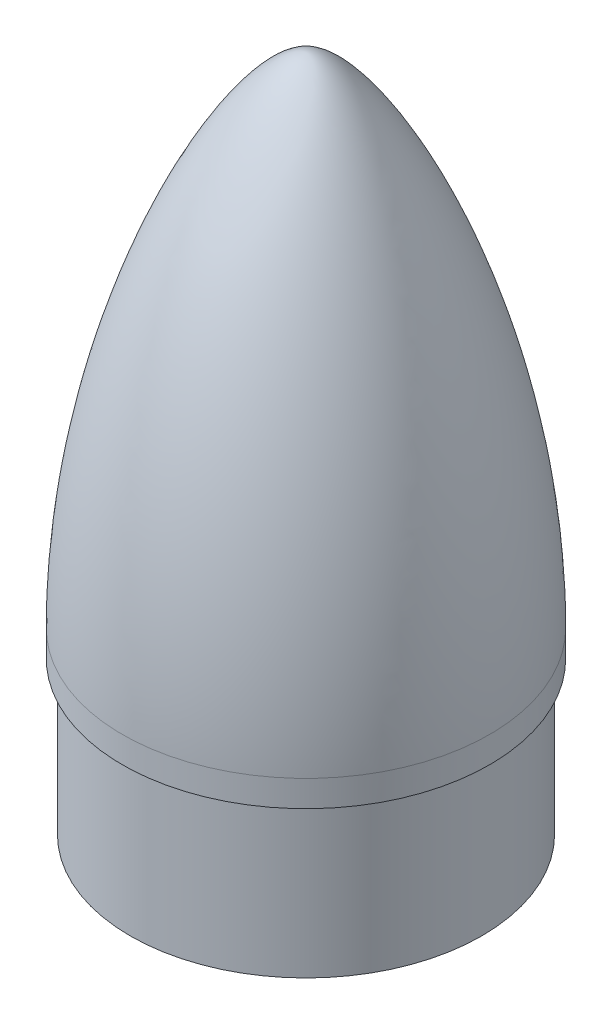
from build123d import *

# Parameters (mm, degrees)
BOSS_EXTRUDE1_START = -2
SKETCH2_R           = 33.5
BOSS_EXTRUDE1_DEPTH = 2
SKETCH3_W           = 10
SKETCH3_H           = 15
CUT_EXTRUDE1_DEPTH  = 2


with BuildPart() as part:
    # Sketch1 → Revolve1 (revolve)
    with BuildSketch(Plane.XY, mode=Mode.PRIVATE) as revolve1_sk:
        with BuildLine():
            Line((-33.5, 0), (-33.5, 29))
            Line((-33.5, 29), (-35, 29))
            Line((-35, 29), (-35, 34))
            add(Edge.make_bspline(
                [(-35, 34), (-35, 84.230477341), (-10.204077545, 129), (0, 129)],
                knots=[0, 0, 0, 0, 1, 1, 1, 1], degree=3))
            Line((0, 129), (0, 128))
            add(Edge.make_bspline(
                [(-33.998483451, 34.678650605), (-33.991581263, 36.224092512), (-33.93035746, 39.323038638), (-33.628011861, 45.449717858), (-32.930147658, 52.999936547), (-31.637237127, 61.816356904), (-29.381428766, 73.174794828), (-25.705936414, 86.483124789), (-20.381782509, 100.569855924), (-15.566274854, 110.353659681), (-11.721562917, 116.772432581), (-8.903323702, 120.821784375), (-6.216251644, 124.044106905), (-4.149084944, 125.985259834), (-2.652724981, 127.059465204), (-1.628060193, 127.620483156), (-0.879863894, 127.88514238), (-0.348657385, 127.984548618), (-0.119526866, 128), (0, 128)],
                knots=[0.004535476, 0.004535476, 0.004535476, 0.004535476, 0.035643742, 0.066752009, 0.128968542, 0.191185074, 0.253401607, 0.377834673, 0.502267738, 0.626700804, 0.688917336, 0.751133869, 0.813350402, 0.875566935, 0.906675201, 0.937783467, 0.968891734, 0.984445867, 1, 1, 1, 1], degree=3))
            Line((-33.998483451, 34.678650605), (-34, 33.678651755))
            Line((-34, 33.678651755), (-34, 30))
            Line((-34, 30), (-32.5, 30))
            Line((-32.5, 30), (-32.5, 0))
            Line((-32.5, 0), (-33.5, 0))
        make_face()
    revolve(revolve1_sk.sketch.rotate(Axis((0, 0, 0), (0, 1, 0)), 270), axis=Axis((0, 0, 0), (0, 1, 0)))

    # Sketch2 → Boss-Extrude1 (add)
    with BuildSketch(Plane.XZ.offset(BOSS_EXTRUDE1_START)):
        with Locations(Location((0, 0, 0), (0, 0, 270))):
            Circle(SKETCH2_R)
    extrude(amount=BOSS_EXTRUDE1_DEPTH)

    # Sketch3 → Cut-Extrude1 (cut)
    with BuildSketch(Plane.XZ):
        with Locations((7.5, 0)):
            Rectangle(SKETCH3_W, SKETCH3_H)
        with Locations((-7.5, 0)):
            Rectangle(SKETCH3_W, SKETCH3_H)
    extrude(amount=-CUT_EXTRUDE1_DEPTH, mode=Mode.SUBTRACT)


solid = part.part
